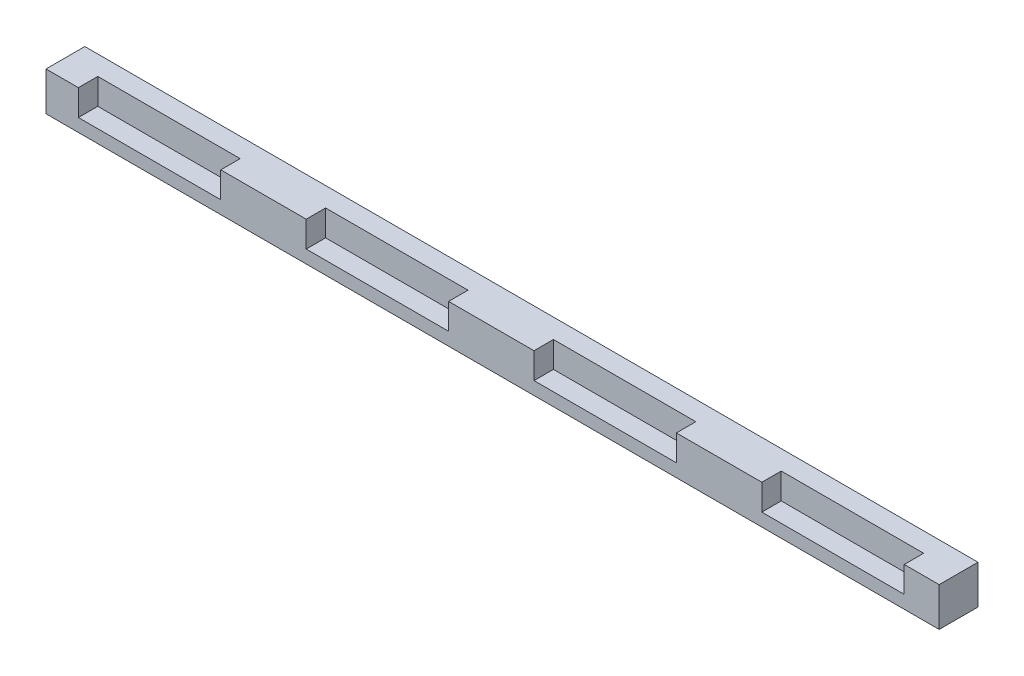
from build123d import *

# Parameters (mm, degrees)
SKETCH_1_W             = 690
SKETCH_1_H             = 30
EXTRUDE_1_DEPTH        = 30
SKETCH_2_W             = 110
SKETCH_2_H             = 15
CUT_EXTRUDE_1_DEPTH    = 20
PATTERN_LINEAR_1_COUNT = 4
PATTERN_LINEAR_1_PITCH = 176


with BuildPart() as part:
    # Эскиз1 → Бобышка-Вытянуть1 (new body)
    with BuildSketch(Plane.XY):
        with Locations((389.050320868, 22.631091658)):
            Rectangle(SKETCH_1_W, SKETCH_1_H)
    extrude(amount=EXTRUDE_1_DEPTH)

    # Эскиз2 → Вырез-Вытянуть1 (cut)
    with BuildSketch(Plane(origin=(0, 37.631091658, 0), x_dir=(1, 0, 0), z_dir=(0, 1, 0))):
        with Locations((124.050320868, -22.5)):
            Rectangle(SKETCH_2_W, SKETCH_2_H)
    cut_extrude_1 = extrude(amount=-CUT_EXTRUDE_1_DEPTH, mode=Mode.SUBTRACT)

    # Линейный массив1: Вырез-Вытянуть1 ×4
    with Locations(*[(i * PATTERN_LINEAR_1_PITCH, 0, 0) for i in range(1, PATTERN_LINEAR_1_COUNT)]):
        add(cut_extrude_1, mode=Mode.SUBTRACT)


solid = part.part
